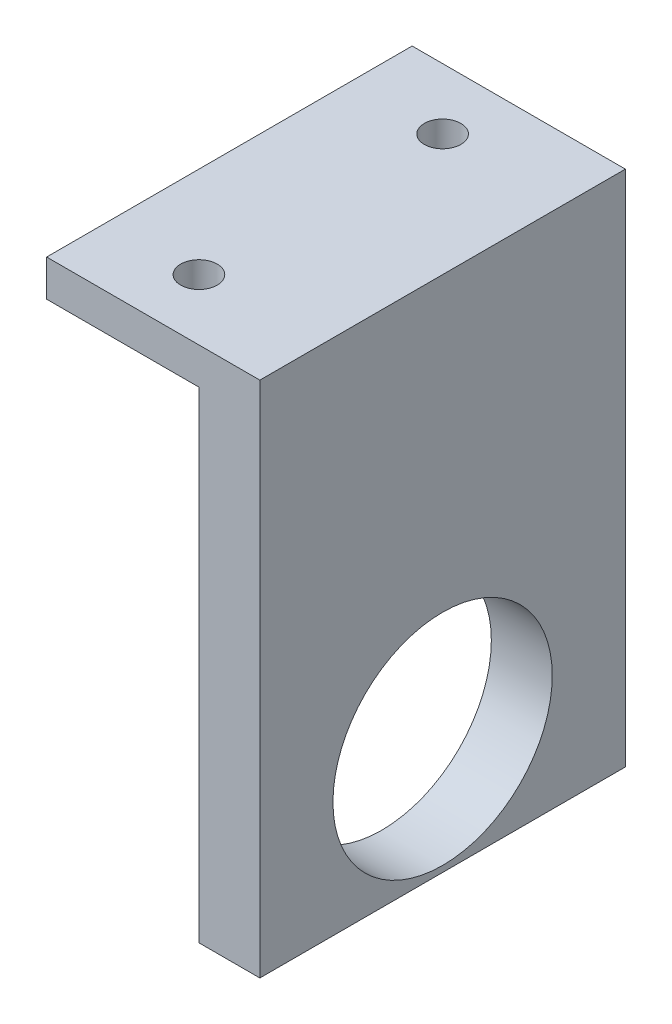
from build123d import *

# Parameters (mm, degrees)
SKETCH_1_W          = 30
SKETCH_1_H          = 39.5
EXTRUDE_1_DEPTH     = 5
SKETCH_2_R          = 9
CUT_EXTRUDE_1_DEPTH = 5
SKETCH_3_W          = 17.5
SKETCH_3_H          = 30
EXTRUDE_2_DEPTH     = 3
SKETCH_6_R          = 1.5
CUT_EXTRUDE_2_DEPTH = 3


with BuildPart() as part:
    # 草图1 → 凸台-拉伸1 (new body)
    with BuildSketch(Plane(origin=(0, 0, 0), x_dir=(0, 0, -1), z_dir=(1, 0, 0))):
        with Locations((0, -8.75)):
            Rectangle(SKETCH_1_W, SKETCH_1_H)
    extrude(amount=EXTRUDE_1_DEPTH)

    # 草图2 → 切除-拉伸1 (cut)
    with BuildSketch(Plane(origin=(5, 0, 0), x_dir=(0, 0, -1), z_dir=(1, 0, 0))):
        with Locations(Location((0, -19, 0), (0, 0, 90))):
            Circle(SKETCH_2_R)
    extrude(amount=-CUT_EXTRUDE_1_DEPTH, mode=Mode.SUBTRACT)

    # 草图3 → 凸台-拉伸2 (add)
    with BuildSketch(Plane(origin=(0, 11, 0), x_dir=(1, 0, 0), z_dir=(0, 1, 0))):
        with Locations((-3.75, 0)):
            Rectangle(SKETCH_3_W, SKETCH_3_H)
    extrude(amount=EXTRUDE_2_DEPTH)

    # 草图6 → 切除-拉伸2 (cut)
    with BuildSketch(Plane(origin=(0, 14, 0), x_dir=(1, 0, 0), z_dir=(0, 1, 0))):
        with Locations(Location((-5, 10, 0), (0, 0, 270))):
            Circle(SKETCH_6_R)
        with Locations(Location((-5, -10, 0), (0, 0, 270))):
            Circle(SKETCH_6_R)
    extrude(amount=-CUT_EXTRUDE_2_DEPTH, mode=Mode.SUBTRACT)


solid = part.part
